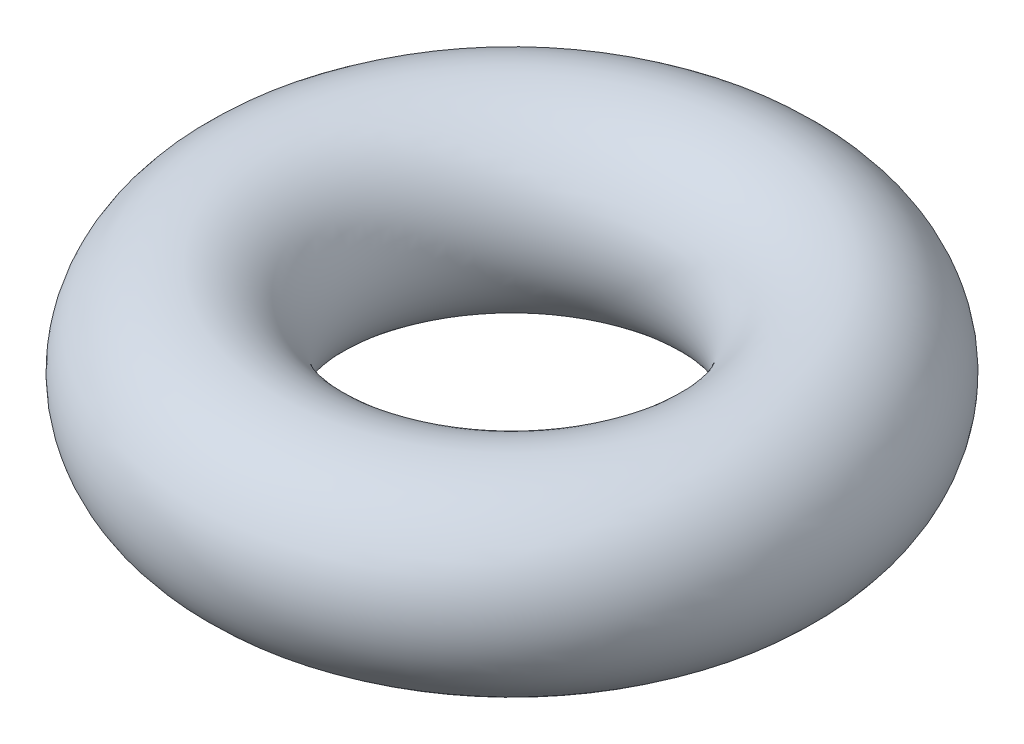
from build123d import *

# Parameters (mm, degrees)
CROQUIS1_R = 1


with BuildPart() as part:
    # Croquis1 → Revolución1 (revolve)
    with BuildSketch(Plane.XY, mode=Mode.PRIVATE) as revoluci_n1_sk:
        with Locations((2.5, 0)):
            Circle(CROQUIS1_R)
    revolve(revoluci_n1_sk.sketch.rotate(Axis((0, 0, 0), (0, 1, 0)), 90), axis=Axis((0, 0, 0), (0, 1, 0)))


solid = part.part
